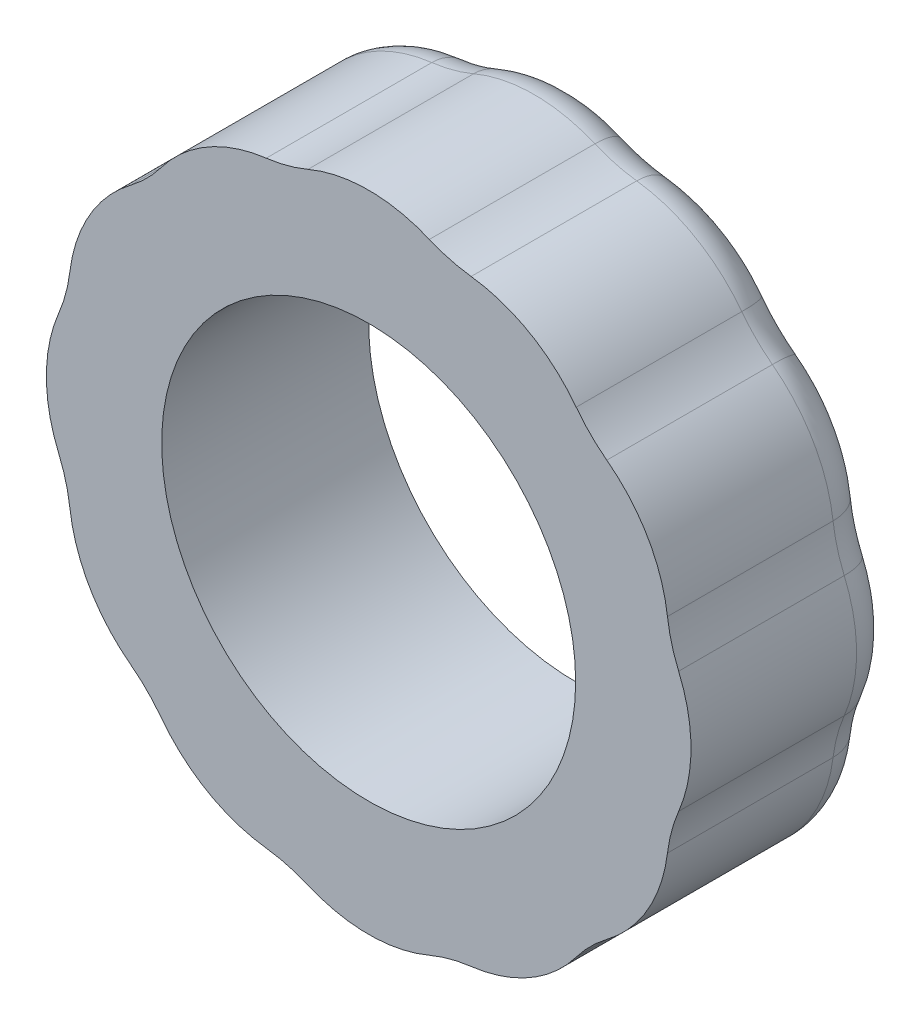
from build123d import *

# Parameters (mm, degrees)
SKETCH1_R           = 1
BOSS_EXTRUDE1_DEPTH = 0.5
FILLET1_R           = 0.75
FILLET2_R           = 0.2


with BuildPart() as part:
    # Sketch1 → Boss-Extrude1 (new, symmetric)
    with BuildSketch(Plane.XY):
        with BuildLine():
            ThreePointArc((-0.388228568, 1.448888739), (0, 1.557188982), (0.388228568, 1.448888739))
            ThreePointArc((0.388228568, 1.448888739), (0.778594491, 1.348565217), (1.060660172, 1.060660172))
            ThreePointArc((1.060660172, 1.060660172), (1.348565217, 0.778594491), (1.448888739, 0.388228568))
            ThreePointArc((1.448888739, 0.388228568), (1.557188982, 0), (1.448888739, -0.388228568))
            ThreePointArc((1.448888739, -0.388228568), (1.348565217, -0.778594491), (1.060660172, -1.060660172))
            ThreePointArc((1.060660172, -1.060660172), (0.778594491, -1.348565217), (0.388228568, -1.448888739))
            ThreePointArc((0.388228568, -1.448888739), (0, -1.557188982), (-0.388228568, -1.448888739))
            ThreePointArc((-0.388228568, -1.448888739), (-0.778594491, -1.348565217), (-1.060660172, -1.060660172))
            ThreePointArc((-1.060660172, -1.060660172), (-1.348565217, -0.778594491), (-1.448888739, -0.388228568))
            ThreePointArc((-1.448888739, -0.388228568), (-1.557188982, 0), (-1.448888739, 0.388228568))
            ThreePointArc((-1.448888739, 0.388228568), (-1.348565217, 0.778594491), (-1.060660172, 1.060660172))
            ThreePointArc((-1.060660172, 1.060660172), (-0.778594491, 1.348565217), (-0.388228568, 1.448888739))
        make_face()
        Circle(SKETCH1_R, mode=Mode.SUBTRACT)
    extrude(amount=BOSS_EXTRUDE1_DEPTH, both=True)

    # Fillet1
    fillet1_edges = [part.edges().sort_by_distance(p)[0] for p in [
        (1.060660172, 1.060660172, 0),
        (1.448888739, 0.388228568, 0),
        (1.448888739, -0.388228568, 0),
        (1.060660172, -1.060660172, 0),
        (0.388228568, -1.448888739, 0),
        (-0.388228568, -1.448888739, 0),
        (-1.060660172, -1.060660172, 0),
        (-1.448888739, -0.388228568, 0),
        (-1.448888739, 0.388228568, 0),
        (-1.060660172, 1.060660172, 0),
        (-0.388228568, 1.448888739, 0),
        (0.388228568, 1.448888739, 0),
    ]]
    fillet(fillet1_edges, radius=FILLET1_R)

    # Fillet2
    fillet2_edges = [part.edges().sort_by_distance(p)[0] for p in [
        (-1.348565217, -0.778594491, -0.5),
        (-1.557188982, 0, -0.5),
        (-0.778594491, -1.348565217, -0.5),
        (0, -1.557188982, -0.5),
        (0.778594491, -1.348565217, -0.5),
        (1.557188982, 0, -0.5),
        (1.348565217, -0.778594491, -0.5),
        (1.348565217, 0.778594491, -0.5),
        (0.778594491, 1.348565217, -0.5),
        (0, 1.557188982, -0.5),
        (-0.778594491, 1.348565217, -0.5),
        (-1.348565217, 0.778594491, -0.5),
        (-1.46344024, -0.392127631, -0.5),
        (-1.07131261, -1.07131261, -0.5),
        (-0.392127631, -1.46344024, -0.5),
        (0.392127631, -1.46344024, -0.5),
        (1.46344024, -0.392127631, -0.5),
        (1.46344024, 0.392127631, -0.5),
        (1.07131261, -1.07131261, -0.5),
        (1.07131261, 1.07131261, -0.5),
        (0.392127631, 1.46344024, -0.5),
        (-0.392127631, 1.46344024, -0.5),
        (-1.07131261, 1.07131261, -0.5),
        (-1.46344024, 0.392127631, -0.5),
    ]]
    fillet(fillet2_edges, radius=FILLET2_R)


solid = part.part
